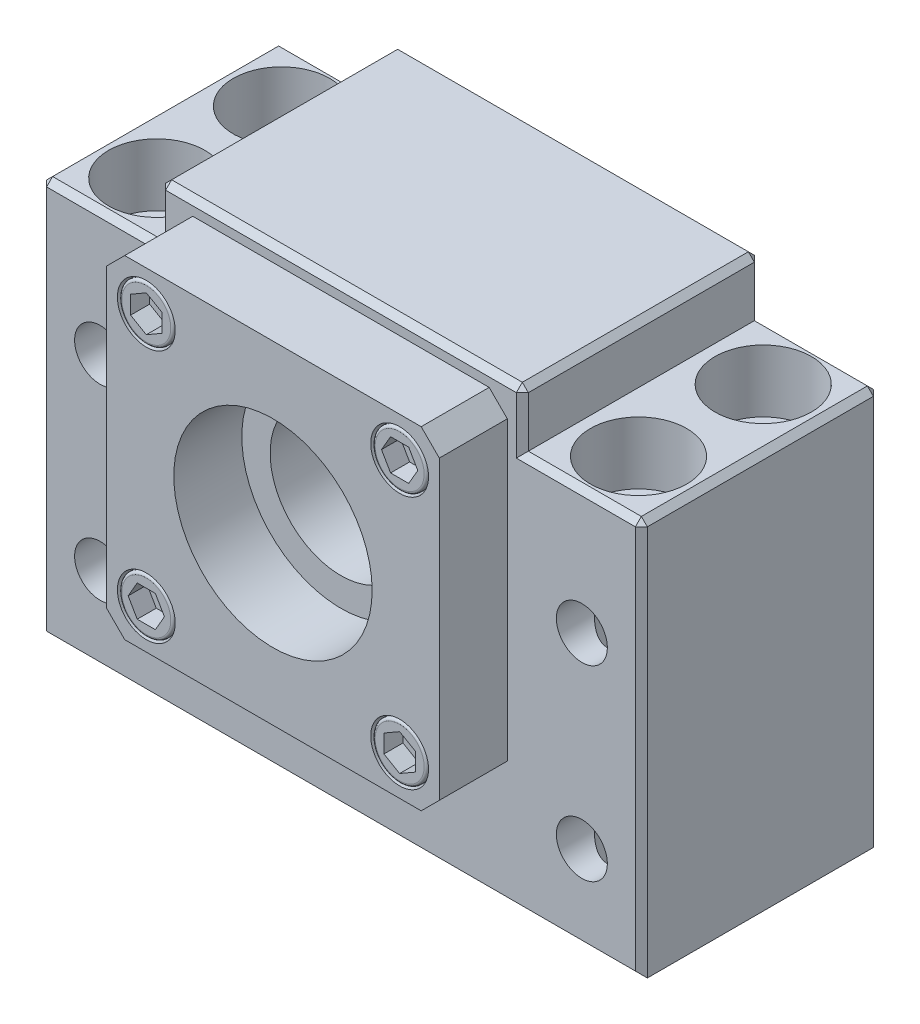
from build123d import *

# Parameters (mm, degrees)
EXTRUDE_1_DEPTH                  = 21
EXTRUDE_1_DEPTH_BACK             = 21
CHAMFER_1_SIZE                   = 1.06
SKETCH_10_R                      = 5.5
CUT_EXTRUDE_4_DEPTH              = 70
SKETCH_11_R                      = 8.5
CUT_EXTRUDE_5_DEPTH              = 11
SKETCH_13_R                      = 4.5
CUT_EXTRUDE_7_DEPTH              = 105.752088285
SKETCH_6_W                       = 58.7
SKETCH_6_H                       = 58.7
EXTRUDE_2_DEPTH                  = 33
CHAMFER_2_SIZE                   = 3.2
SKETCH_7_R                       = 5.1
SKETCH_7_R_2                     = 4.8
CUT_EXTRUDE_1_DEPTH              = 5.76
CUT_EXTRUDE_6_DEPTH              = 3.36
SKETCH_8_R                       = 17.5
CUT_EXTRUDE_2_DEPTH              = 12
SKETCH_9_R                       = 12.5
CUT_EXTRUDE_3_DEPTH              = 42
FILLET_1_R                       = 0.48
PATTERN_CIRCULAR_3_COUNT         = 4
FILLET_1_OF_PATTERN_CIRCULAR_3_R = 0.48


with BuildPart() as part:
    # 草图3 → 凸台-拉伸1 (new, two sides: drawn at the far end of the back side and taken through both)
    with BuildSketch(Plane.XY.offset(-EXTRUDE_1_DEPTH_BACK)):
        Polygon((-53, 70), (-53, 0), (53, 0), (53, 70), (32, 70), (32, 80), (-32, 80), (-32, 70), align=None)
    extrude(amount=EXTRUDE_1_DEPTH + EXTRUDE_1_DEPTH_BACK)

    # 倒角1
    chamfer_1_edges = [part.edges().sort_by_distance(p)[0] for p in [
        (0, 0, 21),
        (53, 35, 21),
        (-32, 80, 0),
        (32, 80, 0),
        (53, 70, 0),
        (-53, 70, 0),
        (42.5, 70, 21),
        (32, 75, 21),
        (-42.5, 70, -21),
        (-32, 75, -21),
        (0, 80, -21),
        (32, 75, -21),
        (42.5, 70, -21),
        (53, 35, -21),
        (0, 80, 21),
        (0, 0, -21),
        (-53, 35, -21),
        (-32, 75, 21),
        (-42.5, 70, 21),
        (-53, 35, 21),
    ]]
    chamfer(chamfer_1_edges, length=CHAMFER_1_SIZE)

    # 草图10 → 切除-拉伸4 (cut)
    with BuildSketch(Plane(origin=(0, 70, 0), x_dir=(1, 0, 0), z_dir=(0, 1, 0))):
        with Locations(Location((-42.5, 11, 0), (0, 0, 180))):
            Circle(SKETCH_10_R)
        with Locations(Location((-42.5, -11, 0), (0, 0, 180))):
            Circle(SKETCH_10_R)
    cut_extrude_4 = extrude(amount=-CUT_EXTRUDE_4_DEPTH, mode=Mode.SUBTRACT)

    # 草图11 → 切除-拉伸5 (cut)
    with BuildSketch(Plane(origin=(0, 70, 0), x_dir=(1, 0, 0), z_dir=(0, 1, 0))):
        with Locations(Location((-42.5, 11, 0), (0, 0, 180))):
            Circle(SKETCH_11_R)
        with Locations(Location((-42.5, -11, 0), (0, 0, 180))):
            Circle(SKETCH_11_R)
    cut_extrude_5 = extrude(amount=-CUT_EXTRUDE_5_DEPTH, mode=Mode.SUBTRACT)

    # 草图13 → 切除-拉伸7 (cut, through all)
    with BuildSketch(Plane.XY.offset(21)):
        with Locations((-42.5, 48)):
            Circle(SKETCH_13_R)
        with Locations((-42.5, 15)):
            Circle(SKETCH_13_R)
    cut_extrude_7 = extrude(amount=-CUT_EXTRUDE_7_DEPTH, mode=Mode.SUBTRACT)

    # 镜向1: 切除-拉伸4, 切除-拉伸5, 切除-拉伸7 across plane
    add(cut_extrude_4.mirror(Plane(origin=(0, 0, 0), x_dir=(0, 0, 1), z_dir=(1, 0, 0))), mode=Mode.SUBTRACT)
    add(cut_extrude_5.mirror(Plane(origin=(0, 0, 0), x_dir=(0, 0, 1), z_dir=(1, 0, 0))), mode=Mode.SUBTRACT)
    add(cut_extrude_7.mirror(Plane(origin=(0, 0, 0), x_dir=(0, 0, 1), z_dir=(1, 0, 0))), mode=Mode.SUBTRACT)

    # 草图6 → 凸台-拉伸2 (add)
    with BuildSketch(Plane.XY):
        with Locations((0, 48)):
            Rectangle(SKETCH_6_W, SKETCH_6_H)
    extrude(amount=EXTRUDE_2_DEPTH)

    # 倒角2
    chamfer_2_edges = [part.edges().sort_by_distance(p)[0] for p in [
        (29.35, 77.35, 27),
        (-29.35, 77.35, 27),
        (-29.35, 18.65, 27),
        (29.35, 18.65, 27),
    ]]
    chamfer(chamfer_2_edges, length=CHAMFER_2_SIZE)

    # 草图7 → 切除-拉伸1 (cut)
    with BuildSketch(Plane.XY.offset(33)):
        with Locations((22.35, 70.35)):
            Circle(SKETCH_7_R)
        with Locations((22.35, 70.35)):
            Circle(SKETCH_7_R_2, mode=Mode.SUBTRACT)
    cut_extrude_1 = extrude(amount=-CUT_EXTRUDE_1_DEPTH, mode=Mode.SUBTRACT)

    # 草图12 → 切除-拉伸6 (cut)
    with BuildSketch(Plane.XY.offset(33)):
        Polygon((25.55, 70.35), (23.95, 73.121281292), (20.75, 73.121281292), (19.15, 70.35), (20.75, 67.578718708), (23.95, 67.578718708), align=None)
    cut_extrude_6 = extrude(amount=-CUT_EXTRUDE_6_DEPTH, mode=Mode.SUBTRACT)

    # 草图8 → 切除-拉伸2 (cut)
    with BuildSketch(Plane.XY.offset(33)):
        with Locations((0, 48)):
            Circle(SKETCH_8_R)
    extrude(amount=-CUT_EXTRUDE_2_DEPTH, mode=Mode.SUBTRACT)

    # 草图9 → 切除-拉伸3 (cut)
    with BuildSketch(Plane.XY.offset(21)):
        with Locations((0, 48)):
            Circle(SKETCH_9_R)
    extrude(amount=-CUT_EXTRUDE_3_DEPTH, mode=Mode.SUBTRACT)

    # 圆角1
    fillet_1_edges = [part.edges().sort_by_distance(p)[0] for p in [
        (17.55, 70.35, 33),
    ]]
    fillet(fillet_1_edges, radius=FILLET_1_R)

    # 阵列(圆周)3: 切除-拉伸1, 切除-拉伸6 ×4 about axis
    pattern_circular_3_axis = Axis((0, 48, 0), (0, 0, 1))
    add([cut_extrude_1.rotate(pattern_circular_3_axis, i * 360 / PATTERN_CIRCULAR_3_COUNT) for i in range(1, PATTERN_CIRCULAR_3_COUNT)], mode=Mode.SUBTRACT)
    add([cut_extrude_6.rotate(pattern_circular_3_axis, i * 360 / PATTERN_CIRCULAR_3_COUNT) for i in range(1, PATTERN_CIRCULAR_3_COUNT)], mode=Mode.SUBTRACT)

    # 圆角1 of 阵列(圆周)3
    fillet_1_of_pattern_circular_3_edges = [part.edges().sort_by_distance(p)[0] for p in [
        (-22.35, 65.55, 33),
        (-17.55, 25.65, 33),
        (22.35, 30.45, 33),
    ]]
    fillet(fillet_1_of_pattern_circular_3_edges, radius=FILLET_1_OF_PATTERN_CIRCULAR_3_R)


solid = part.part
